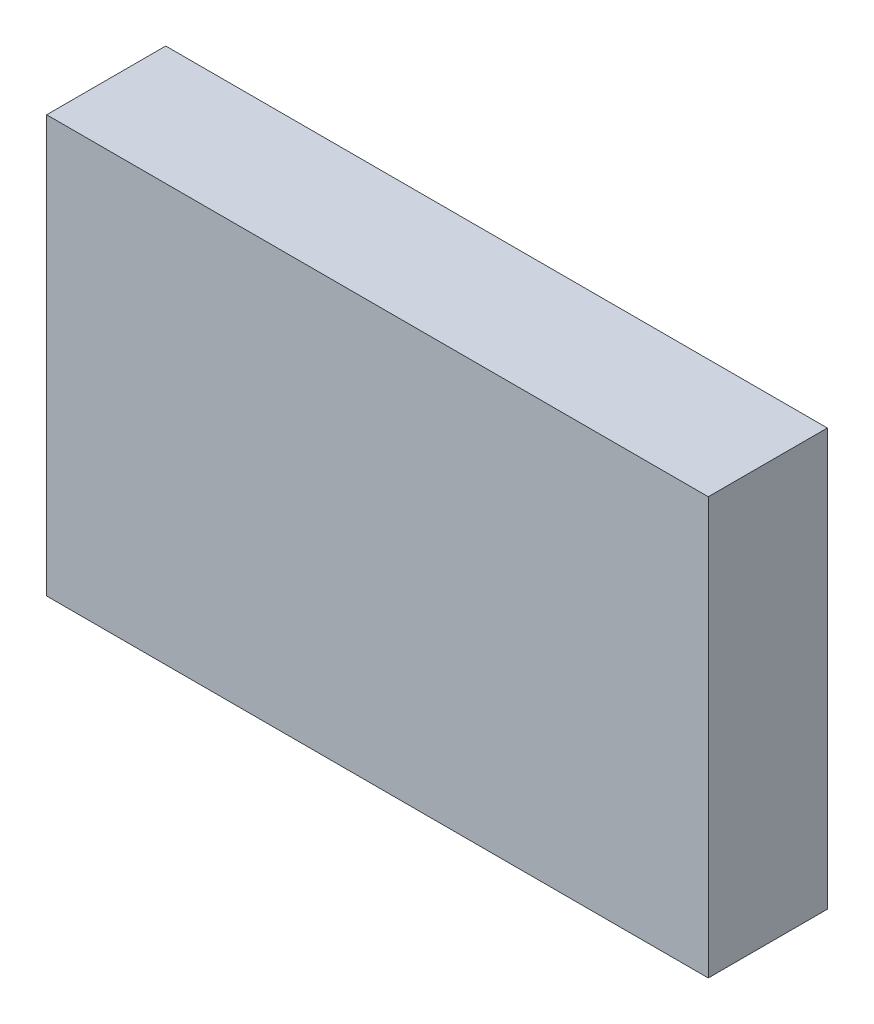
from build123d import *

# Parameters (mm, degrees)
SKETCH1_W           = 6.35
SKETCH1_H           = 4
BOSS_EXTRUDE1_DEPTH = 1.143


with BuildPart() as part:
    # Sketch1 → Boss-Extrude1 (new body)
    with BuildSketch(Plane.XY):
        Rectangle(SKETCH1_W, SKETCH1_H)
    extrude(amount=BOSS_EXTRUDE1_DEPTH)


solid = part.part
